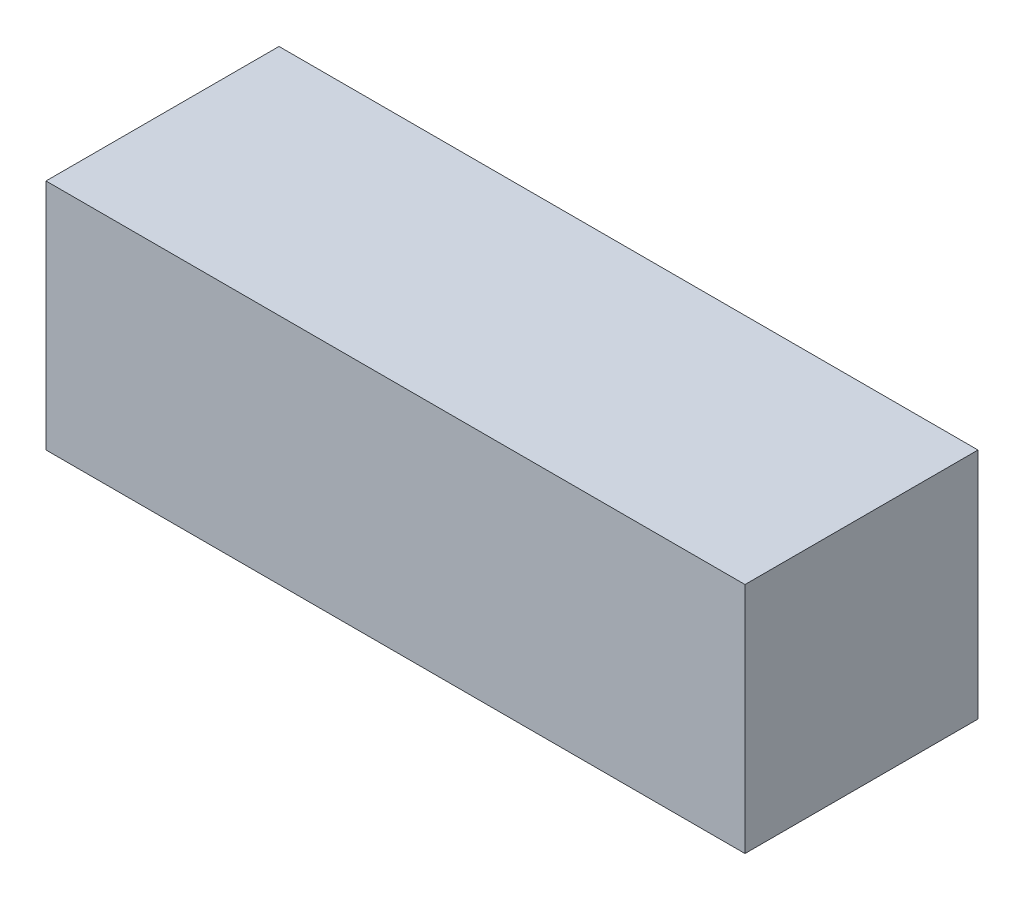
from build123d import *

# Parameters (mm, degrees)
SKETCH1_W           = 152.4
SKETCH1_H           = 50.8
BOSS_EXTRUDE1_DEPTH = 50.8


with BuildPart() as part:
    # Sketch1 → Boss-Extrude1 (new body)
    with BuildSketch(Plane(origin=(0, 0, 0), x_dir=(1, 0, 0), z_dir=(0, 1, 0))):
        with Locations((76.2, 25.4)):
            Rectangle(SKETCH1_W, SKETCH1_H)
    extrude(amount=BOSS_EXTRUDE1_DEPTH)


solid = part.part
